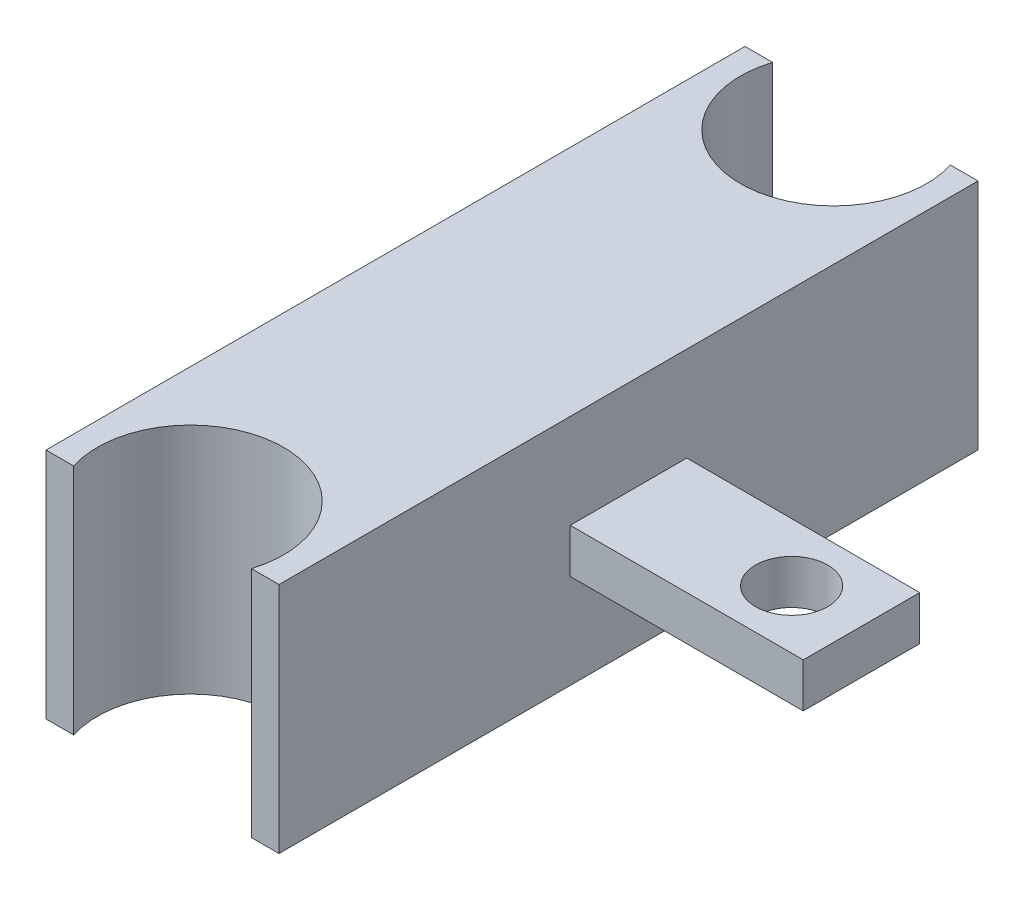
from build123d import *

# Parameters (mm, degrees)
SKETCH_1_W          = 10
SKETCH_1_H          = 5
SKETCH_1_R          = 1.55
EXTRUDE_1_DEPTH     = 1.9
SKETCH_2_W          = 30
SKETCH_2_H          = 10
EXTRUDE_2_DEPTH     = 10
SKETCH_3_R          = 4
CUT_EXTRUDE_1_DEPTH = 10


with BuildPart() as part:
    # 草图1 → 凸台-拉伸1 (new body)
    with BuildSketch(Plane(origin=(0, 0, 0), x_dir=(1, 0, 0), z_dir=(0, 1, 0))):
        with Locations((5, 2.5)):
            Rectangle(SKETCH_1_W, SKETCH_1_H)
        with Locations(Location((7, 2.5, 0), (0, 0, 90))):
            Circle(SKETCH_1_R, mode=Mode.SUBTRACT)
    extrude(amount=EXTRUDE_1_DEPTH)

    # 草图2 → 凸台-拉伸2 (add)
    with BuildSketch(Plane.ZY):
        with Locations((-2.5, 0.95)):
            Rectangle(SKETCH_2_W, SKETCH_2_H)
    extrude(amount=EXTRUDE_2_DEPTH)

    # 草图3 → 切除-拉伸1 (cut)
    with BuildSketch(Plane(origin=(0, 5.95, 0), x_dir=(1, 0, 0), z_dir=(0, 1, 0))):
        with Locations((-5, 16.3)):
            Circle(SKETCH_3_R)
        with Locations((-5, -11.3)):
            Circle(SKETCH_3_R)
    extrude(amount=-CUT_EXTRUDE_1_DEPTH, mode=Mode.SUBTRACT)


solid = part.part
